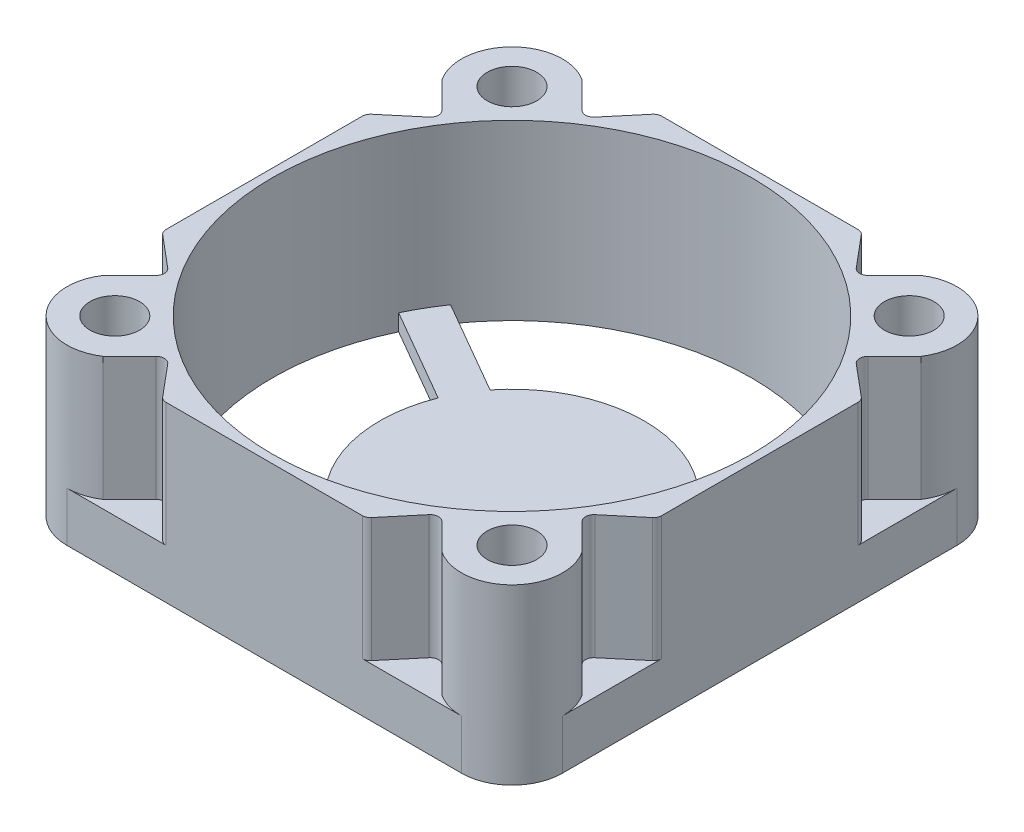
from build123d import *

# Parameters (mm, degrees)
SKETCH2_W           = 30
SKETCH2_H           = 30
SKETCH2_R           = 14.5
BOSS_EXTRUDE1_DEPTH = 10.5
BOSS_EXTRUDE2_DEPTH = 1
SKETCH4_R           = 1.5
CUT_EXTRUDE1_DEPTH  = 24.669600757
CUT_EXTRUDE2_DEPTH  = 7.5
FILLET1_R           = 0.5


with BuildPart() as part:
    # Sketch2 → Boss-Extrude1 (new body)
    with BuildSketch(Plane(origin=(0, 0, 0), x_dir=(1, 0, 0), z_dir=(0, 1, 0))):
        Rectangle(SKETCH2_W, SKETCH2_H)
        Circle(SKETCH2_R, mode=Mode.SUBTRACT)
    extrude(amount=BOSS_EXTRUDE1_DEPTH)

    # Sketch3 → Boss-Extrude2 (add)
    with BuildSketch(Plane.XZ):
        with BuildLine():
            Line((-1.15, 14.454324612), (-1.15, 7.916912277))
            ThreePointArc((-1.15, 7.916912277), (-6.92820323, 4), (-7.431247151, -2.962526924))
            Line((-7.431247151, -2.962526924), (-13.092812309, -6.231233092))
            ThreePointArc((-13.092812309, -6.231233092), (-12.557368355, -7.25), (-11.942812309, -8.223091521))
            Line((-11.942812309, -8.223091521), (-6.281247151, -4.954385353))
            ThreePointArc((-6.281247151, -4.954385353), (0, -8), (6.281247151, -4.954385353))
            Line((6.281247151, -4.954385353), (11.942812309, -8.223091521))
            ThreePointArc((11.942812309, -8.223091521), (12.557368355, -7.25), (13.092812309, -6.231233092))
            Line((13.092812309, -6.231233092), (7.431247151, -2.962526924))
            ThreePointArc((7.431247151, -2.962526924), (6.92820323, 4), (1.15, 7.916912277))
            Line((1.15, 7.916912277), (1.15, 14.454324612))
            ThreePointArc((1.15, 14.454324612), (0, 14.5), (-1.15, 14.454324612))
        make_face()
    extrude(amount=-BOSS_EXTRUDE2_DEPTH)

    # Sketch4 → Cut-Extrude1 (cut, through all)
    with BuildSketch(Plane(origin=(0, 10.5, 0), x_dir=(1, 0, 0), z_dir=(0, 1, 0))):
        with BuildLine():
            Line((-15, 15), (-15, 11.936859783))
            ThreePointArc((-15, 11.936859783), (-14.102826997, 14.102826999), (-11.936859779, 15))
            Line((-11.936859779, 15), (-15, 15))
        make_face()
        with BuildLine():
            ThreePointArc((-11.936859768, -15), (-14.102826997, -14.102826998), (-15, -11.93685977))
            Line((-15, -11.93685977), (-15, -15))
            Line((-15, -15), (-11.936859768, -15))
        make_face()
        with BuildLine():
            Line((15, 15), (11.936859768, 15))
            ThreePointArc((11.936859768, 15), (14.102826999, 14.102826997), (15, 11.936859766))
            Line((15, 11.936859766), (15, 15))
        make_face()
        with BuildLine():
            ThreePointArc((15, -11.936859768), (14.102826999, -14.102826997), (11.93685977, -15))
            Line((11.93685977, -15), (15, -15))
            Line((15, -15), (15, -11.936859768))
        make_face()
        with Locations((-12.02081528, 12.02081528)):
            Circle(SKETCH4_R)
        with Locations((12.02081528, 12.02081528)):
            Circle(SKETCH4_R)
        with Locations((12.02081528, -12.02081528)):
            Circle(SKETCH4_R)
        with Locations((-12.02081528, -12.02081528)):
            Circle(SKETCH4_R)
    extrude(amount=-CUT_EXTRUDE1_DEPTH, mode=Mode.SUBTRACT)

    # Sketch4<3> → Cut-Extrude2 (cut)
    with BuildSketch(Plane(origin=(0, 10.5, 0), x_dir=(1, 0, 0), z_dir=(0, 1, 0))):
        with BuildLine():
            Line((-12.506075058, 8.263434371), (-14.495689014, 10.253048327))
            ThreePointArc((-14.495689014, 10.253048327), (-14.871214971, 11.058003908), (-15, 11.936859783))
            Line((-15, 11.936859783), (-15, 6.170782872))
            Line((-15, 6.170782872), (-12.506075058, 8.263434371))
        make_face()
        with BuildLine():
            Line((-6.170782872, 15), (-11.936859779, 15))
            ThreePointArc((-11.936859779, 15), (-11.058003907, 14.871214971), (-10.253048327, 14.495689014))
            Line((-10.253048327, 14.495689014), (-8.263434371, 12.506075058))
            Line((-8.263434371, 12.506075058), (-6.170782872, 15))
        make_face()
        with BuildLine():
            Line((-12.506075058, -8.263434371), (-15, -6.170782872))
            Line((-15, -6.170782872), (-15, -11.93685977))
            ThreePointArc((-15, -11.93685977), (-14.871214969, -11.058003902), (-14.495689014, -10.253048327))
            Line((-14.495689014, -10.253048327), (-12.506075058, -8.263434371))
        make_face()
        with BuildLine():
            Line((11.936859768, 15), (6.170782872, 15))
            Line((6.170782872, 15), (8.263434371, 12.506075058))
            Line((8.263434371, 12.506075058), (10.253048327, 14.495689014))
            ThreePointArc((10.253048327, 14.495689014), (11.058003901, 14.871214969), (11.936859768, 15))
        make_face()
        with BuildLine():
            ThreePointArc((-10.253048327, -14.495689014), (-11.058003901, -14.871214969), (-11.936859768, -15))
            Line((-11.936859768, -15), (-6.170782872, -15))
            Line((-6.170782872, -15), (-8.263434371, -12.506075058))
            Line((-8.263434371, -12.506075058), (-10.253048327, -14.495689014))
        make_face()
        with BuildLine():
            Line((14.495689014, 10.253048327), (12.506075058, 8.263434371))
            Line((12.506075058, 8.263434371), (15, 6.170782872))
            Line((15, 6.170782872), (15, 11.936859766))
            ThreePointArc((15, 11.936859766), (14.871214969, 11.0580039), (14.495689014, 10.253048327))
        make_face()
        with BuildLine():
            Line((10.253048327, -14.495689014), (8.263434371, -12.506075058))
            Line((8.263434371, -12.506075058), (6.170782872, -15))
            Line((6.170782872, -15), (11.93685977, -15))
            ThreePointArc((11.93685977, -15), (11.058003902, -14.871214969), (10.253048327, -14.495689014))
        make_face()
        with BuildLine():
            Line((15, -6.170782872), (12.506075058, -8.263434371))
            Line((12.506075058, -8.263434371), (14.495689014, -10.253048327))
            ThreePointArc((14.495689014, -10.253048327), (14.871214969, -11.058003901), (15, -11.936859768))
            Line((15, -11.936859768), (15, -6.170782872))
        make_face()
    extrude(amount=-CUT_EXTRUDE2_DEPTH, mode=Mode.SUBTRACT)

    # Fillet1
    fillet1_edges = [part.edges().sort_by_distance(p)[0] for p in [
        (-6.170782872, 6.75, -15),
        (-8.263434371, 6.75, -12.506075058),
        (6.170782872, 6.75, -15),
        (8.263434371, 6.75, -12.506075058),
        (12.506075058, 6.75, -8.263434371),
        (15, 6.75, -6.170782872),
        (15, 6.75, 6.170782872),
        (12.506075058, 6.75, 8.263434371),
        (-12.506075058, 6.75, -8.263434371),
        (-15, 6.75, -6.170782872),
        (-15, 6.75, 6.170782872),
        (-12.506075058, 6.75, 8.263434371),
        (8.263434371, 6.75, 12.506075058),
        (6.170782872, 6.75, 15),
        (-6.170782872, 6.75, 15),
        (-8.263434371, 6.75, 12.506075058),
    ]]
    fillet(fillet1_edges, radius=FILLET1_R)


solid = part.part
